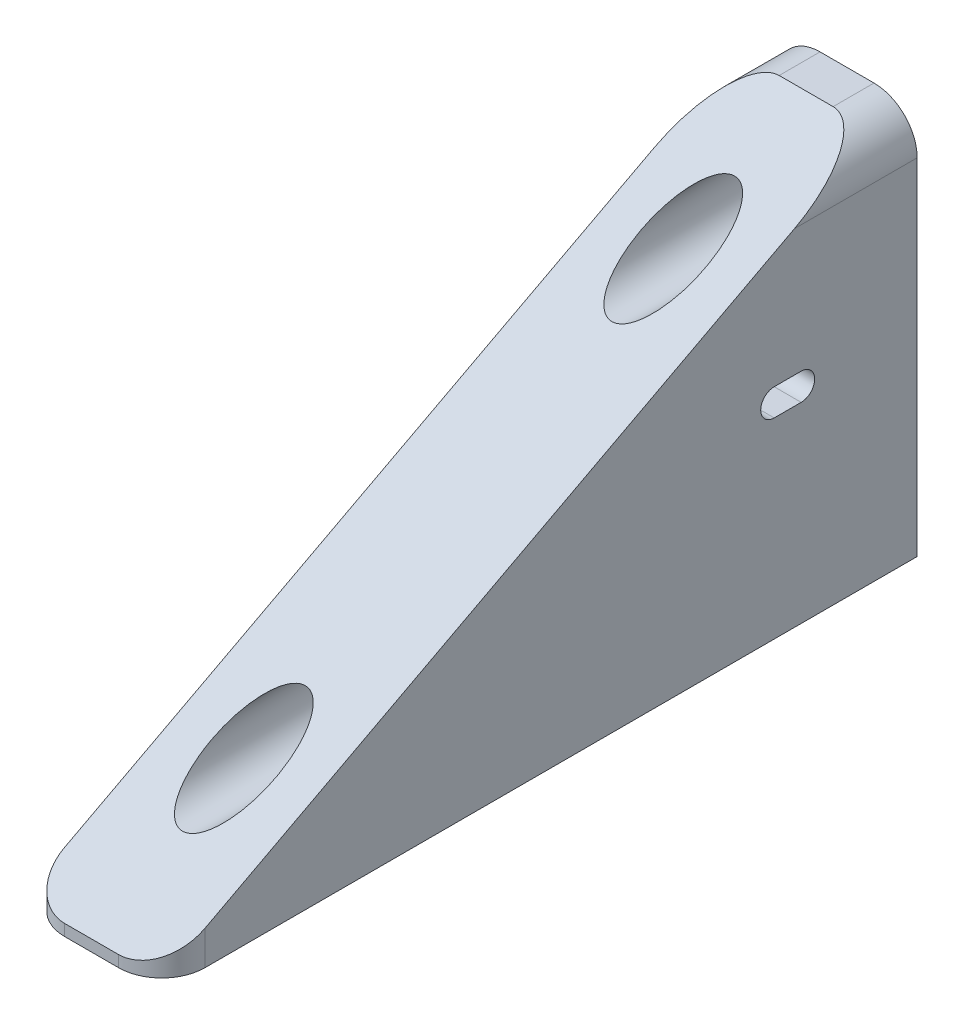
from build123d import *
from OCP.BRepFilletAPI import BRepFilletAPI_MakeChamfer

# Parameters (mm, degrees)
BOSS_EXTRUDE1_DEPTH     = 6.5
SKETCH2_R               = 1.575
CUT_EXTRUDE1_DEPTH      = 75.74790967
CUT_EXTRUDE2_START      = 5
SKETCH2_3_R             = 3
CUT_EXTRUDE2_DEPTH      = 70.74790967
CUT_EXTRUDE3_DEPTH      = 75.74790967
CUT_EXTRUDE3_DEPTH_BACK = 75.74790967
CHAMFER1_SIZE           = 2
CHAMFER1_SIZE2          = 2.26145916
CHAMFER1_SIZE2_2        = 4.284869987
FILLET2_R               = 4


with BuildPart() as part:
    # Sketch1 → Boss-Extrude1 (new, symmetric)
    with BuildSketch(Plane(origin=(0, 0, 0), x_dir=(0, 0, -1), z_dir=(1, 0, 0))):
        Polygon((0, 19), (0, -19), (-72, -19), align=None)
    extrude(amount=BOSS_EXTRUDE1_DEPTH, both=True)

    # Sketch2 → Cut-Extrude1 (cut, through all)
    with BuildSketch(Plane.XY):
        with Locations((0, 10.5)):
            Circle(SKETCH2_R)
        with Locations((0, -10.5)):
            Circle(SKETCH2_R)
    extrude(amount=CUT_EXTRUDE1_DEPTH, mode=Mode.SUBTRACT)

    # Sketch2<3> → Cut-Extrude2 (cut, through all)
    with BuildSketch(Plane.XY.offset(CUT_EXTRUDE2_START)):
        with Locations((0, 10.5)):
            Circle(SKETCH2_3_R)
        with Locations((0, -10.5)):
            Circle(SKETCH2_3_R)
    extrude(amount=CUT_EXTRUDE2_DEPTH, mode=Mode.SUBTRACT)

    # Sketch5 → Cut-Extrude3 (cut, two sides: drawn at the far end of the back side and taken through both)
    with BuildSketch(Plane(origin=(0, 0, 0), x_dir=(0, 0, -1), z_dir=(1, 0, 0)).offset(-CUT_EXTRUDE3_DEPTH_BACK)):
        with BuildLine():
            Line((-13.25, 1.25), (-10.75, 1.25))
            ThreePointArc((-10.75, 1.25), (-9.5, 0), (-10.75, -1.25))
            Line((-10.75, -1.25), (-13.25, -1.25))
            ThreePointArc((-13.25, -1.25), (-14.5, 0), (-13.25, 1.25))
        make_face()
    extrude(amount=CUT_EXTRUDE3_DEPTH + CUT_EXTRUDE3_DEPTH_BACK, mode=Mode.SUBTRACT)

    # Chamfer1: one chamfer whose edges measure the first distance from different faces: ONE call of the kernel's chamfer builder (chamfer() names one face for all edges)
    chamfer1_edges_1 = [part.edges().sort_by_distance(p)[0] for p in [
        (0, -19, 72),
    ]]
    chamfer1_side_1 = [part.faces().sort_by_distance(p)[0] for p in [
        (0, -19, 36),
    ]]
    chamfer1_edges_2 = [part.edges().sort_by_distance(p)[0] for p in [
        (0, 19, 0),
    ]]
    chamfer1_side_2 = [part.faces().sort_by_distance(p)[0] for p in [
        (0, 0, 0),
    ]]
    chamfer1 = BRepFilletAPI_MakeChamfer(part.part.solid().wrapped)
    for e in chamfer1_edges_1:
        chamfer1.Add(CHAMFER1_SIZE, CHAMFER1_SIZE2, e.wrapped, chamfer1_side_1[0].wrapped)  # the first distance lies on this face
    for e in chamfer1_edges_2:
        chamfer1.Add(CHAMFER1_SIZE, CHAMFER1_SIZE2_2, e.wrapped, chamfer1_side_2[0].wrapped)  # the first distance lies on this face
    add(Compound.cast(chamfer1.Shape()), mode=Mode.REPLACE)

    # Fillet2
    fillet2_edges = [part.edges().sort_by_distance(p)[0] for p in [
        (-6.5, 17, 1.894736842),
        (6.5, 17, 1.894736842),
        (6.5, -18.472222222, 70),
        (-6.5, -18.472222222, 70),
    ]]
    fillet(fillet2_edges, radius=FILLET2_R)


solid = part.part
